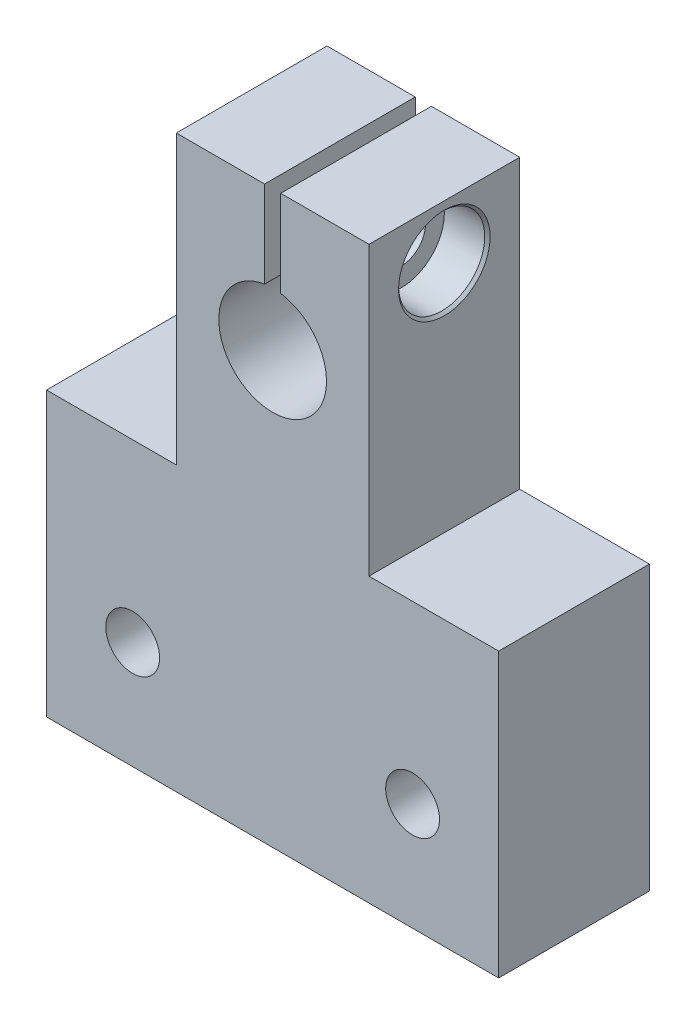
from build123d import *

# Parameters (mm, degrees)
BOSS_EXTRUDE1_DEPTH   = 7
M4X0_7_TAPPED_HOLE1_D = 3.3
SKETCH7_W             = 42
SKETCH7_H             = 14
BOSS_EXTRUDE2_DEPTH   = 20
SKETCH8_R             = 2.5
CUT_EXTRUDE2_DEPTH    = 28


with BuildPart() as part:
    # Sketch1 → Boss-Extrude1 (new, symmetric)
    with BuildSketch(Plane.XY):
        with BuildLine():
            Line((-21, 6.3), (-8.95, 6.3))
            Line((-8.95, 6.3), (-8.95, 33))
            Line((-8.95, 33), (-0.75, 33))
            Line((-0.75, 33), (-0.75, 24.943429983))
            ThreePointArc((-0.75, 24.943429983), (0, 15), (0.75, 24.943429983))
            Line((0.75, 24.943429983), (0.75, 33))
            Line((0.75, 33), (8.95, 33))
            Line((8.95, 33), (8.95, 6.3))
            Line((8.95, 6.3), (21, 6.3))
            Line((21, 6.3), (21, 0))
            Line((21, 0), (-21, 0))
            Line((-21, 0), (-21, 6.3))
        make_face()
    extrude(amount=BOSS_EXTRUDE1_DEPTH, both=True)

    # Sketch4 → CBORE for M4 SHCS2 (revolve, cut)
    with BuildSketch(Plane(origin=(8.95, 28, 0), x_dir=(0, 0, -1), z_dir=(0, 1, 0))):
        Polygon((0, 0), (0, 8.2), (2.25, 8.2), (2.25, 4), (4, 4), (4, 0.25), (4.25, 0), align=None)
    revolve(axis=Axis((15.3, 28, 0), (-1, 0, 0)), mode=Mode.SUBTRACT)

    # M4x0.7 Tapped Hole1 (through all)
    with Locations(Plane(origin=(-0.75, 0, 0), x_dir=(0, 0, -1), z_dir=(1, 0, 0))):
        with Locations((0, 28)):
            Hole(M4X0_7_TAPPED_HOLE1_D / 2)

    # Sketch7 → Boss-Extrude2 (add)
    with BuildSketch(Plane.XZ):
        Rectangle(SKETCH7_W, SKETCH7_H)
    extrude(amount=BOSS_EXTRUDE2_DEPTH)

    # Sketch8 → Cut-Extrude2 (cut)
    with BuildSketch(Plane.XY.offset(7)):
        with Locations((-13, -10)):
            Circle(SKETCH8_R)
        with Locations((13, -10)):
            Circle(SKETCH8_R)
    extrude(amount=-CUT_EXTRUDE2_DEPTH, mode=Mode.SUBTRACT)


solid = part.part
